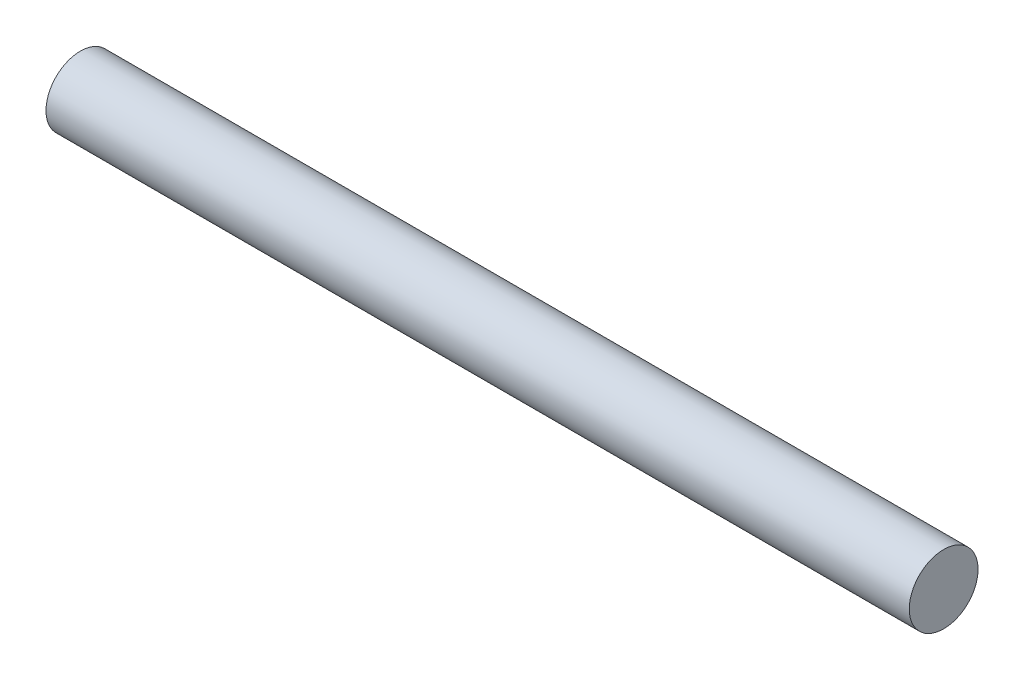
from build123d import *

# Parameters (mm, degrees)
SKETCH2_W = 1600
SKETCH2_H = 63.75


with BuildPart() as part:
    # Sketch2 → Revolve1 (revolve)
    with BuildSketch(Plane(origin=(0, 0, 0), x_dir=(1, 0, 0), z_dir=(0, 1, 0))):
        with Locations((800, 31.875)):
            Rectangle(SKETCH2_W, SKETCH2_H)
    revolve(axis=Axis((1600, 0, -63.75), (-1, 0, 0)))


solid = part.part
